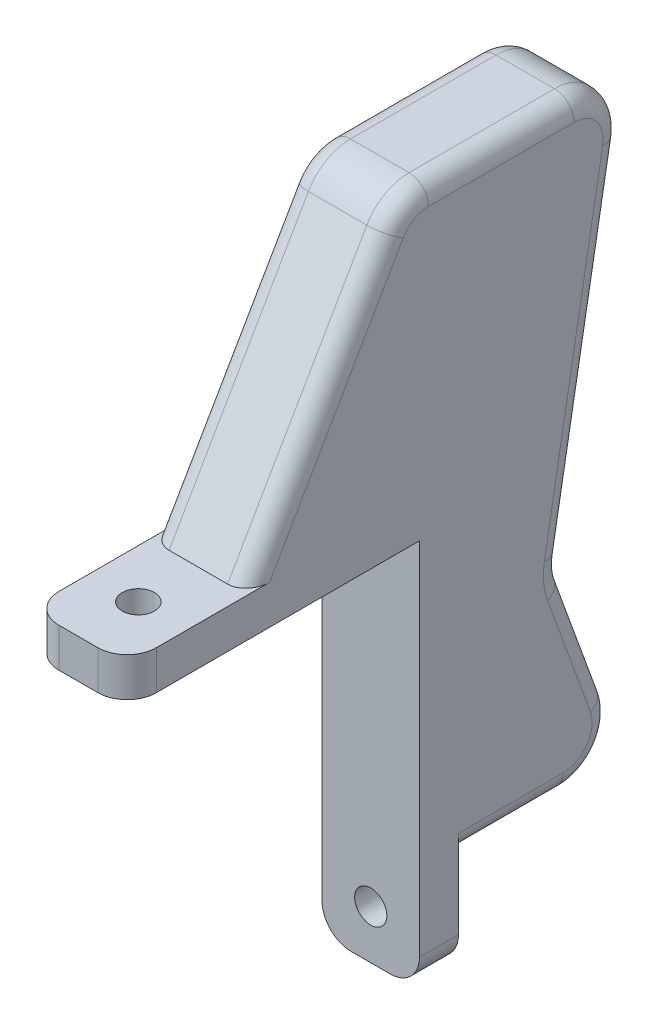
from build123d import *

# Parameters (mm, degrees)
BOSS_EXTRUDE1_DEPTH = 10
FILLET1_R           = 5
BOSS_EXTRUDE2_DEPTH = 4
SKETCH3_R           = 1.65
CUT_EXTRUDE1_DEPTH  = 55.081290223
BOSS_EXTRUDE3_DEPTH = 4
SKETCH5_R           = 1.65
CUT_EXTRUDE2_DEPTH  = 54.441556864
FILLET2_R           = 3
FILLET3_R           = 2


with BuildPart() as part:
    # Sketch1 → Boss-Extrude1 (new body)
    with BuildSketch(Plane(origin=(0, 0, 0), x_dir=(0, 0, -1), z_dir=(1, 0, 0))):
        Polygon((0, 0), (20, 0), (20, -30), (41.868360094, -30), (34.553508963, -9.90261169), (41.809544604, 31.248411326), (18.041278691, 31.248411326), align=None)
    extrude(amount=BOSS_EXTRUDE1_DEPTH)

    # Fillet1
    fillet1_edges = [part.edges().sort_by_distance(p)[0] for p in [
        (5, 31.248411326, -18.041278691),
        (5, 31.248411326, -41.809544604),
        (5, -9.90261169, -34.553508963),
        (5, -30, -41.868360094),
    ]]
    fillet(fillet1_edges, radius=FILLET1_R)

    # Sketch2 → Boss-Extrude2 (add)
    with BuildSketch(Plane.XZ):
        Polygon((0, -20), (0, 0), (0, 10), (10, 10), (10, 0), (10, -20), align=None)
    extrude(amount=-BOSS_EXTRUDE2_DEPTH)

    # Sketch3 → Cut-Extrude1 (cut, through all)
    with BuildSketch(Plane(origin=(0, 4, 0), x_dir=(1, 0, 0), z_dir=(0, 1, 0))):
        with Locations(Location((5, -3.845299462, 0), (0, 0, 270))):
            Circle(SKETCH3_R)
    extrude(amount=-CUT_EXTRUDE1_DEPTH, mode=Mode.SUBTRACT)

    # Sketch4 → Boss-Extrude3 (add)
    with BuildSketch(Plane.XY.offset(-20)):
        Polygon((0, 0), (0, -30), (0, -40), (10, -40), (10, -30), (10, 0), align=None)
    extrude(amount=-BOSS_EXTRUDE3_DEPTH)

    # Sketch5 → Cut-Extrude2 (cut, through all)
    with BuildSketch(Plane(origin=(0, 0, -24), x_dir=(-1, 0, 0), z_dir=(0, 0, -1))):
        with Locations((-5, -35)):
            Circle(SKETCH5_R)
    extrude(amount=-CUT_EXTRUDE2_DEPTH, mode=Mode.SUBTRACT)

    # Fillet2
    fillet2_edges = [part.edges().sort_by_distance(p)[0] for p in [
        (10, 2, 10),
        (0, 2, 10),
        (0, -40, -22),
        (10, -40, -22),
    ]]
    fillet(fillet2_edges, radius=FILLET2_R)

    # Fillet3
    fillet3_edges = [part.edges().sort_by_distance(p)[0] for p in [
        (0, -17.225730184, -37.218906116),
        (10, -17.225730184, -37.218906116),
        (0, 16.374205663, -9.453652047),
        (0, 31.248411326, -28.389403339),
        (0, 8.398475479, -37.780484407),
        (0, 30.578538345, -18.428030037),
        (0, 29.462349374, -39.680998857),
        (0, -27.867882182, -38.823380282),
        (10, 16.374205663, -9.453652047),
        (10, 8.398475479, -37.780484407),
        (10, 31.248411326, -28.389403339),
        (10, 30.578538345, -18.428030037),
        (10, 29.462349374, -39.680998857),
        (10, -27.867882182, -38.823380282),
        (0, -9.887239081, -34.729218682),
        (10, -9.887239081, -34.729218682),
        (0, -30, -29.36381003),
        (10, -30, -29.36381003),
    ]]
    fillet(fillet3_edges, radius=FILLET3_R)


solid = part.part
